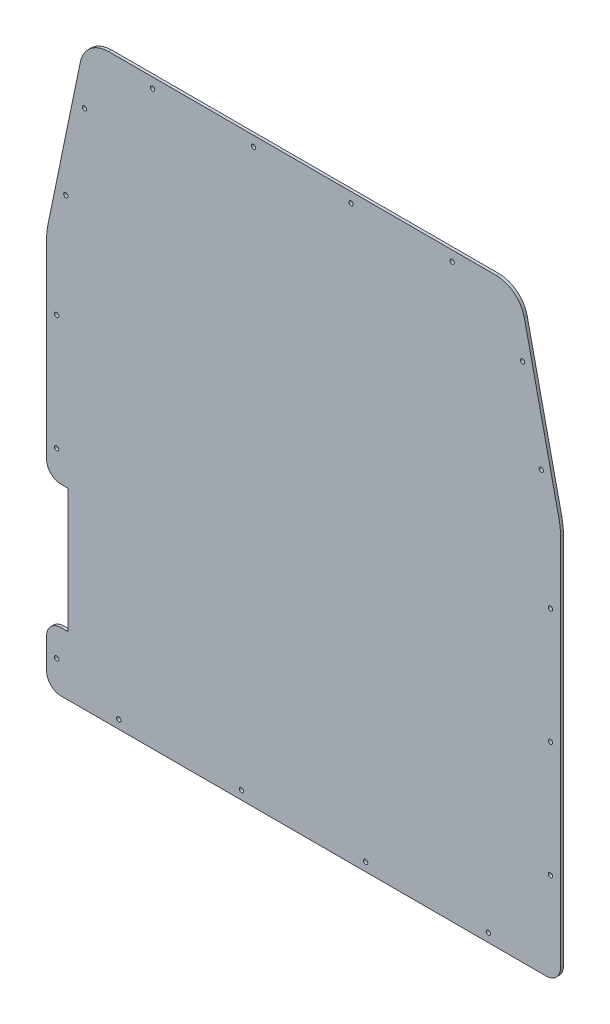
from build123d import *

# Parameters (mm, degrees)
SKETCH1_R           = 1.5
BOSS_EXTRUDE1_DEPTH = 2


with BuildPart() as part:
    # Sketch1 → Boss-Extrude1 (new body)
    with BuildSketch(Plane.XY.offset(-1267.107479839)):
        with BuildLine():
            Line((36.146099055, 1376.306398419), (13.765371143, 1267.870458722))
            ThreePointArc((13.765371143, 1267.870458722), (12.991950286, 1262.843357254), (12.733250996, 1257.763691551))
            Line((12.733250996, 1257.763691551), (12.733250996, 1126.263691551))
            ThreePointArc((12.733250996, 1126.263691551), (15.662183185, 1119.192623739), (22.733250996, 1116.263691551))
            Line((22.733250996, 1116.263691551), (27.733250996, 1116.263691551))
            Line((27.733250996, 1116.263691551), (27.733250996, 1030.263691551))
            Line((27.733250996, 1030.263691551), (22.733250996, 1030.263691551))
            ThreePointArc((22.733250996, 1030.263691551), (15.662183185, 1027.334759363), (12.733250996, 1020.263691551))
            Line((12.733250996, 1020.263691551), (12.733250996, 999.263691551))
            ThreePointArc((12.733250996, 999.263691551), (15.662183185, 992.192623739), (22.733250996, 989.263691551))
            Line((22.733250996, 989.263691551), (358.733250996, 989.263691551))
            ThreePointArc((358.733250996, 989.263691551), (365.804318808, 992.192623739), (368.733250996, 999.263691551))
            Line((368.733250996, 999.263691551), (368.733250996, 1257.766155457))
            ThreePointArc((368.733250996, 1257.766155457), (368.437249077, 1263.198703185), (367.552748004, 1268.566929131))
            Line((367.552748004, 1268.566929131), (343.655165727, 1376.584001021))
            ThreePointArc((343.655165727, 1376.584001021), (336.649224027, 1387.858661724), (324.127366924, 1392.263691551))
            Line((324.127366924, 1392.263691551), (55.733250996, 1392.263691551))
            ThreePointArc((55.733250996, 1392.263691551), (43.101033008, 1387.769402392), (36.146099055, 1376.306398419))
        make_face()
        with Locations((19.733250996, 1010.263691551)):
            Circle(SKETCH1_R, mode=Mode.SUBTRACT)
        with Locations((62.733250996, 995.263691551)):
            Circle(SKETCH1_R, mode=Mode.SUBTRACT)
        with Locations((147.733250996, 995.263691551)):
            Circle(SKETCH1_R, mode=Mode.SUBTRACT)
        with Locations((233.733250996, 995.263691551)):
            Circle(SKETCH1_R, mode=Mode.SUBTRACT)
        with Locations((318.733250996, 995.263691551)):
            Circle(SKETCH1_R, mode=Mode.SUBTRACT)
        with Locations((361.733250996, 1051.263691551)):
            Circle(SKETCH1_R, mode=Mode.SUBTRACT)
        with Locations((361.733250996, 1131.263691551)):
            Circle(SKETCH1_R, mode=Mode.SUBTRACT)
        with Locations((361.733250996, 1211.263691551)):
            Circle(SKETCH1_R, mode=Mode.SUBTRACT)
        with Locations((355.36207357, 1291.263691551)):
            Circle(SKETCH1_R, mode=Mode.SUBTRACT)
        with Locations((342.401145161, 1349.84708796)):
            Circle(SKETCH1_R, mode=Mode.SUBTRACT)
        with Locations((293.655165727, 1385.263691551)):
            Circle(SKETCH1_R, mode=Mode.SUBTRACT)
        with Locations((223.655165727, 1385.263691551)):
            Circle(SKETCH1_R, mode=Mode.SUBTRACT)
        with Locations((156.146099055, 1385.263691551)):
            Circle(SKETCH1_R, mode=Mode.SUBTRACT)
        with Locations((86.146099055, 1385.263691551)):
            Circle(SKETCH1_R, mode=Mode.SUBTRACT)
        with Locations((39.065356832, 1349.84708796)):
            Circle(SKETCH1_R, mode=Mode.SUBTRACT)
        with Locations((26.104428423, 1291.263691551)):
            Circle(SKETCH1_R, mode=Mode.SUBTRACT)
        with Locations((19.733250996, 1216.263691551)):
            Circle(SKETCH1_R, mode=Mode.SUBTRACT)
        with Locations((19.733250996, 1136.263691551)):
            Circle(SKETCH1_R, mode=Mode.SUBTRACT)
    extrude(amount=BOSS_EXTRUDE1_DEPTH)


solid = part.part
